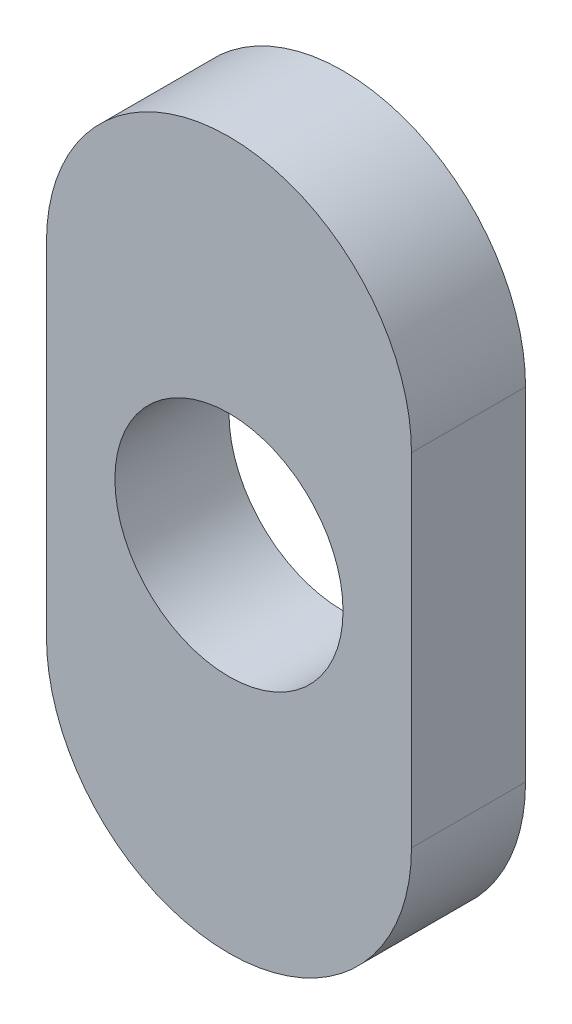
from build123d import *

# Parameters (mm, degrees)
BOSS_EXTRU_1_DEPTH      = 5
ESQUISSE3_R             = 5
ENL_V_MAT_EXTRU_1_DEPTH = 10


with BuildPart() as part:
    # Esquisse2 → Boss.-Extru.1 (new body)
    with BuildSketch(Plane.XY):
        with BuildLine():
            Line((-8, -7.5), (-8, 7.5))
            ThreePointArc((-8, 7.5), (0, 15.5), (8, 7.5))
            Line((8, 7.5), (8, -7.5))
            ThreePointArc((8, -7.5), (0, -15.5), (-8, -7.5))
        make_face()
    extrude(amount=BOSS_EXTRU_1_DEPTH)

    # Esquisse3 → Enlèv. mat.-Extru.1 (cut)
    with BuildSketch(Plane.XY.offset(5)):
        Circle(ESQUISSE3_R)
    extrude(amount=-ENL_V_MAT_EXTRU_1_DEPTH, mode=Mode.SUBTRACT)


solid = part.part
